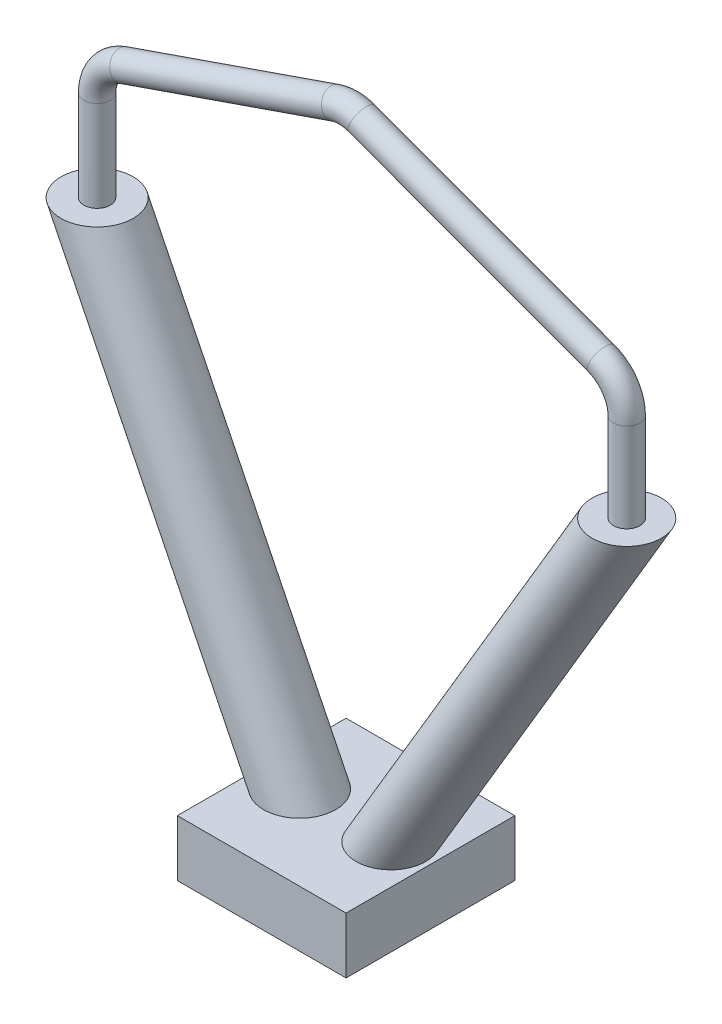
from build123d import *

# Parameters (mm, degrees)
CROQUIS1_W              = 300
CROQUIS1_H              = 300
SALIENTE_EXTRUIR1_DEPTH = 100
CROQUIS2_R              = 61.757793717
CROQUIS3_R              = 64.13831418
CROQUIS5_R              = 23.498626295


with BuildPart() as part:
    # Croquis1 → Saliente-Extruir1 (new body)
    with BuildSketch(Plane(origin=(0, 0, 0), x_dir=(1, 0, 0), z_dir=(0, 1, 0))):
        Rectangle(CROQUIS1_W, CROQUIS1_H)
    extrude(amount=SALIENTE_EXTRUIR1_DEPTH)

    # Barrer1: sweep along a curve in space
    with BuildLine() as barrer1_path:
        Line((79.719719639, 100, 0), (499.017442554, 807.657749643, 0))
    # Croquis2 → Barrer1 (sweep)
    with BuildSketch(Plane(origin=(0, 100, 0), x_dir=(1, 0, 0), z_dir=(0, 1, 0))):
        with Locations((79.719719639, 0)):
            Circle(CROQUIS2_R)
    sweep(path=barrer1_path.line)

    # Barrer2: sweep along a curve in space
    with BuildLine() as barrer2_path:
        Line((-82.576305282, 100, 0), (-442.652634805, 830.366298789, 0))
    # Croquis3 → Barrer2 (sweep)
    with BuildSketch(Plane(origin=(0, 100, 0), x_dir=(1, 0, 0), z_dir=(0, 1, 0))):
        with Locations((-82.576305282, 0)):
            Circle(CROQUIS3_R)
    sweep(path=barrer2_path.line)

    # Barrer4: sweep along a curve in space
    with BuildLine() as barrer4_path:
        Line((499.017442554, 807.657749643, 0), (499.017442554, 965.743179521, 0))
        ThreePointArc((499.017442554, 965.743179521, 0), (486.422687881, 1005.801110184, 0), (453.170648011, 1031.444189149, 0))
        Line((453.170648011, 1031.444189149, 0), (27.99293329, 1187.749316841, 0))
        ThreePointArc((27.99293329, 1187.749316841, 0), (4.508322897, 1192.045114145, 0), (-19.05406022, 1188.19870002, 0))
        Line((-395.546422858, 1057.899604458, 0), (-19.05406022, 1188.19870002, 0))
        ThreePointArc((-442.652634805, 991.749211651, 0), (-429.672653938, 1032.353613113, 0), (-395.546422858, 1057.899604458, 0))
        Line((-442.652634805, 830.366298789, 0), (-442.652634805, 991.749211651, 0))
    # Croquis5 → Barrer4 (sweep)
    with BuildSketch(Plane(origin=(0, 807.657749643, 0), x_dir=(1, 0, 0), z_dir=(0, 1, 0))):
        with Locations((499.017442554, 0)):
            Circle(CROQUIS5_R)
    sweep(path=barrer4_path.line)


solid = part.part
